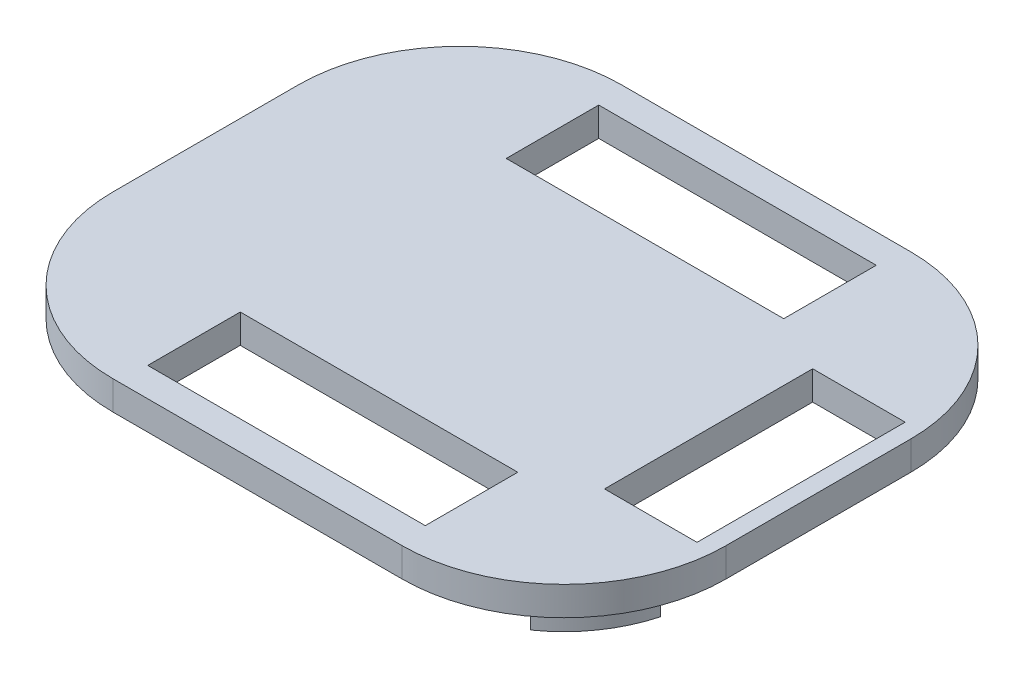
from build123d import *

# Parameters (mm, degrees)
SKETCH1_W           = 8
SKETCH1_H           = 18
SKETCH1_W_2         = 24
SKETCH1_H_2         = 8
BOSS_EXTRUDE1_DEPTH = 2.5
BOSS_EXTRUDE2_DEPTH = 2.6


with BuildPart() as part:
    # Sketch1 → Boss-Extrude1 (new body)
    with BuildSketch(Plane(origin=(0, 0, 0), x_dir=(1, 0, 0), z_dir=(0, 1, 0))):
        with BuildLine():
            Line((-26.5, 8), (-26.5, -8))
            ThreePointArc((-26.5, -8), (-22.399494937, -17.899494937), (-12.5, -22))
            Line((-12.5, -22), (12.5, -22))
            ThreePointArc((12.5, -22), (22.399494937, -17.899494937), (26.5, -8))
            Line((26.5, -8), (26.5, 8))
            ThreePointArc((26.5, 8), (22.399494937, 17.899494937), (12.5, 22))
            Line((12.5, 22), (-12.5, 22))
            ThreePointArc((-12.5, 22), (-22.399494937, 17.899494937), (-26.5, 8))
        make_face()
        with Locations((21, 0)):
            Rectangle(SKETCH1_W, SKETCH1_H, mode=Mode.SUBTRACT)
        with Locations((0, 15.5)):
            Rectangle(SKETCH1_W_2, SKETCH1_H_2, mode=Mode.SUBTRACT)
        with Locations((0, -15.5)):
            Rectangle(SKETCH1_W_2, SKETCH1_H_2, mode=Mode.SUBTRACT)
    extrude(amount=BOSS_EXTRUDE1_DEPTH)

    # Sketch2 → Boss-Extrude2 (add)
    with BuildSketch(Plane.XZ):
        with BuildLine():
            ThreePointArc((18.264443185, -16.232478045), (20.732478045, -13.764443185), (22.207554554, -10.601131403))
            Line((22.207554554, -10.601131403), (23.89792475, -11.054064732))
            ThreePointArc((23.89792475, -11.054064732), (22.165994123, -14.768201949), (19.268201949, -17.665994123))
            Line((19.268201949, -17.665994123), (18.264443185, -16.232478045))
        make_face()
        with BuildLine():
            ThreePointArc((19.268201949, 17.665994123), (22.165994123, 14.768201949), (23.89792475, 11.054064732))
            Line((23.89792475, 11.054064732), (22.207554554, 10.601131403))
            ThreePointArc((22.207554554, 10.601131403), (20.732478045, 13.764443185), (18.264443185, 16.232478045))
            Line((18.264443185, 16.232478045), (19.268201949, 17.665994123))
        make_face()
        with BuildLine():
            Line((-18.264443185, -16.232478045), (-19.268201949, -17.665994123))
            ThreePointArc((-19.268201949, -17.665994123), (-22.165994123, -14.768201949), (-23.89792475, -11.054064732))
            Line((-23.89792475, -11.054064732), (-22.207554554, -10.601131403))
            ThreePointArc((-22.207554554, -10.601131403), (-20.732478045, -13.764443185), (-18.264443185, -16.232478045))
        make_face()
        with BuildLine():
            ThreePointArc((-18.264443185, 16.232478045), (-20.732478045, 13.764443185), (-22.207554554, 10.601131403))
            Line((-22.207554554, 10.601131403), (-23.89792475, 11.054064732))
            ThreePointArc((-23.89792475, 11.054064732), (-22.165994123, 14.768201949), (-19.268201949, 17.665994123))
            Line((-19.268201949, 17.665994123), (-18.264443185, 16.232478045))
        make_face()
    extrude(amount=BOSS_EXTRUDE2_DEPTH)


solid = part.part
